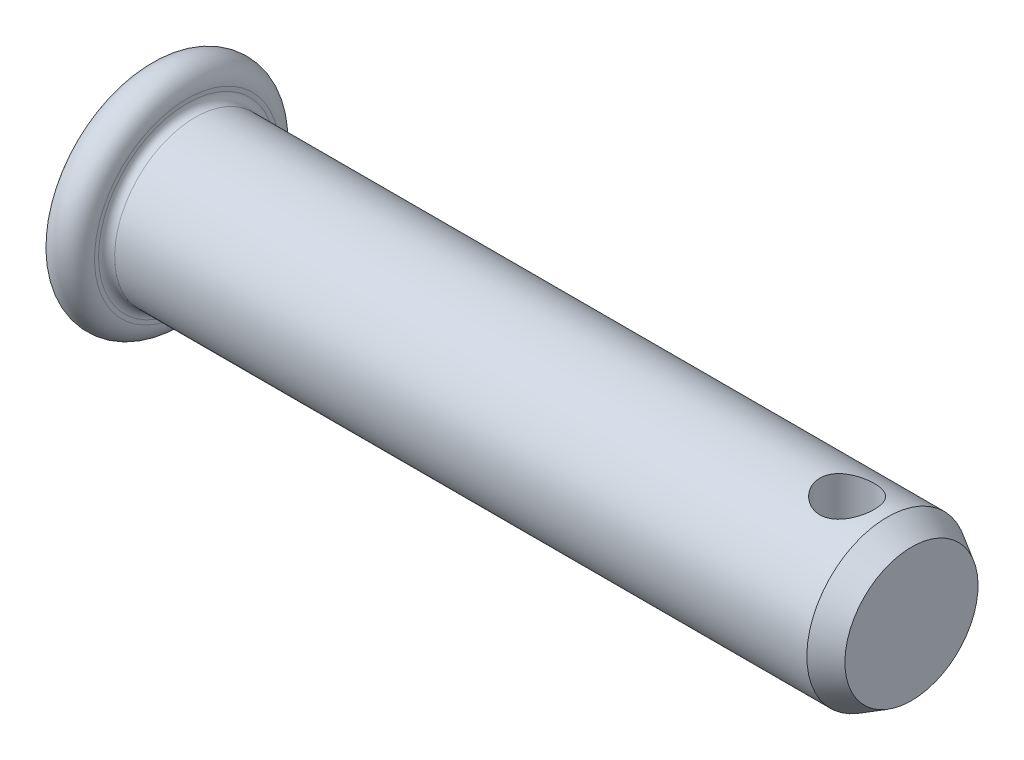
from build123d import *

# Parameters (mm, degrees)
CHAMFER1_R      = 0.5
HOLE_DEPTH      = 49.520614205
HOLE_DEPTH_BACK = 49.520614205
SKETCH2_R       = 1.69


with BuildPart() as part:
    # Sketch1 → BaseBody (revolve)
    with BuildSketch(Plane.XY, mode=Mode.PRIVATE) as basebody_sk:
        with BuildLine():
            Line((47.5, 0), (0, 0))
            Line((0, 0), (0, 5.75))
            ThreePointArc((0, 5.75), (1.25, 7), (2.5, 5.75))
            Line((2.5, 5.75), (2.5, 5))
            Line((2.5, 5), (46, 5))
            Line((46, 5), (47.5, 4.133974596))
            Line((47.5, 4.133974596), (47.5, 0))
        make_face()
    revolve(basebody_sk.sketch.rotate(Axis((-19.830028721, 0, 0), (1, 0, 0)), 180), axis=Axis((-19.830028721, 0, 0), (1, 0, 0)))

    # Chamfer1
    chamfer1_edges = [part.edges().sort_by_distance(p)[0] for p in [
        (2.5, 5, 0),
    ]]
    fillet(chamfer1_edges, radius=CHAMFER1_R)

    # Sketch2 → Hole (cut, two sides: drawn at the far end of the back side and taken through both)
    with BuildSketch(Plane(origin=(0, 0, 0), x_dir=(1, 0, 0), z_dir=(0, 1, 0)).offset(-HOLE_DEPTH_BACK)):
        with Locations(Location((43.5, 0, 0), (0, 0, 270))):
            Circle(SKETCH2_R)
    extrude(amount=HOLE_DEPTH + HOLE_DEPTH_BACK, mode=Mode.SUBTRACT)


solid = part.part
